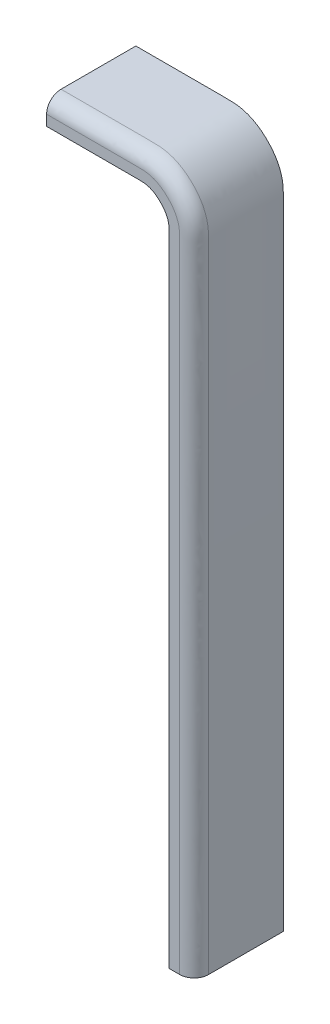
from build123d import *


with BuildPart() as part:
    # Sweep1: sweep along a path in Sketch4
    with BuildLine() as sweep1_path:  # in the path sketch's own coordinates; laid on its plane below (add() does not lay a ready-made edge on the line's plane)
        add(Edge.make_bspline(
            [(47.591788131, 0), (69.745218369, 0), (91.898648606, 0), (114.052078844, 0), (117.709028489, 0), (125.022927778, 0), (137.324763875, -12.301836097), (137.324763875, -19.615735386), (137.324763875, -23.272685031), (137.324763875, -178.520736688), (137.324763875, -333.768788344), (137.324763875, -489.01684)],
            knots=[0, 0, 0, 0, 0.117604481, 0.117604481, 0.117604481, 0.137017893, 0.156431305, 0.175844717, 0.175844717, 0.175844717, 1, 1, 1, 1], degree=3))
    # Sketch5 → Sweep1 (sweep)
    with BuildSketch(Plane(origin=(47.591788131, 0, 0), x_dir=(0, 0, -1), z_dir=(1, 0, 0))):
        with BuildLine():
            Line((-32.673593006, 0), (32.673593006, 0))
            Line((32.673593006, 0), (32.673593006, 18.288))
            Line((32.673593006, 18.288), (-22.104374823, 18.288))
            ThreePointArc((-22.104374823, 18.288), (-29.577940672, 15.192347666), (-32.673593006, 7.718781817))
            Line((-32.673593006, 7.718781817), (-32.673593006, 0))
        make_face()
    sweep(path=Plane.XY.offset(32.673593006) * sweep1_path.line)


solid = part.part
